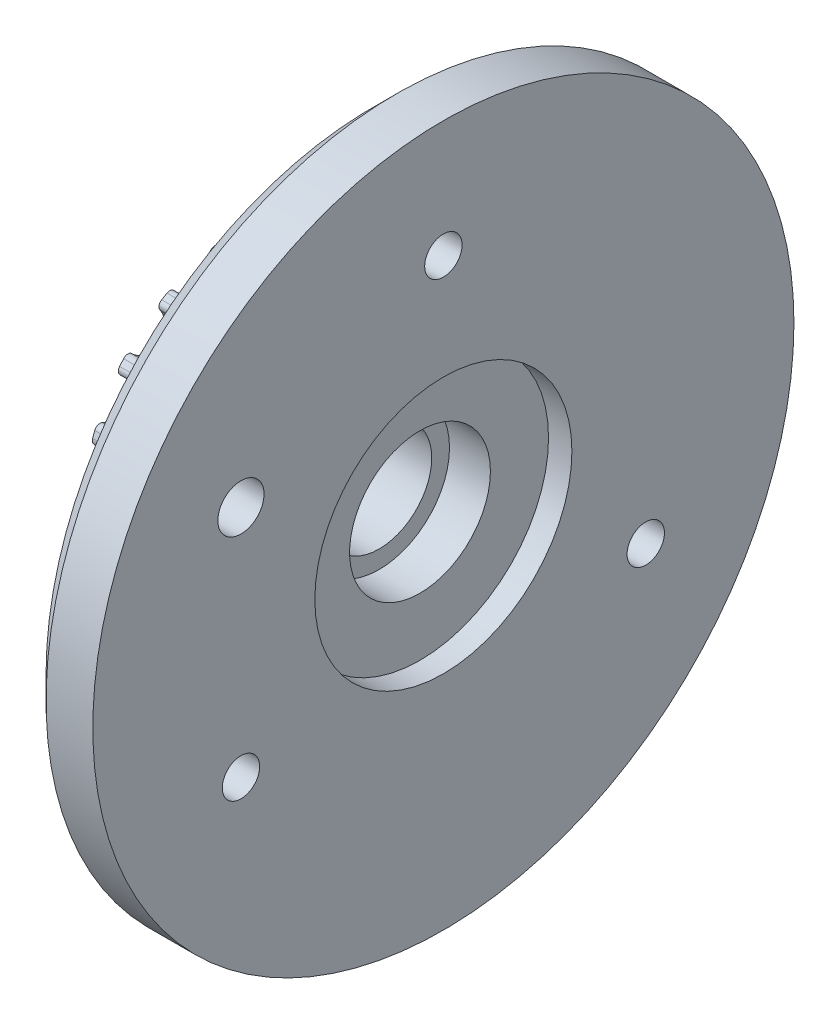
from build123d import *

# Parameters (mm, degrees)
SKETCH_1_W               = 11
SKETCH_1_H               = 10.9642
CUT_EXTRUDE_2_REACH      = 24.345
PATTERN_CIRCULAR_3_COUNT = 18
SKETCH_7_R               = 30
EXTRUDE_1_DEPTH          = 6
SKETCH_8_R               = 2.7888
EXTRUDE_2_DEPTH          = 11
SKETCH_10_R              = 11
CUT_EXTRUDE_3_DEPTH      = 2
SKETCH_11_R              = 1.6
CUT_EXTRUDE_4_DEPTH      = 44.829214002
PATTERN_CIRCULAR_4_COUNT = 3
SKETCH_13_R              = 1.975
CUT_EXTRUDE_5_DEPTH      = 44.829214002
CHAMFER_1_SIZE           = 0.8
CHAMFER_2_SIZE           = 2.5
CUT_EXTRUDE_START        = -15
SKETCH_14_R              = 4
CUT_EXTRUDE_6_DEPTH      = 10
SKETCH_15_R              = 4.5
CUT_EXTRUDE_7_DEPTH      = 46.705579528
CHAMFER_3_SIZE           = 2
SKETCH_17_R              = 6.025
CUT_EXTRUDE_8_DEPTH      = 3.5
CUT_EXTRUDE_START_2      = -3.4
SKETCH_18_R              = 6.025
CUT_EXTRUDE_9_DEPTH      = 3.4


with BuildPart() as part:
    # 草图1 → 旋转1 (revolve)
    with BuildSketch(Plane.XY, mode=Mode.PRIVATE) as revolve_1_sk:
        with Locations((5.5, 8.2709)):
            Rectangle(SKETCH_1_W, SKETCH_1_H)
    revolve(revolve_1_sk.sketch.rotate(Axis((0, 0, 0), (1, 0, 0)), 90), axis=Axis((0, 0, 0), (1, 0, 0)))

    # 草图6 → 切除-拉伸2 (cut, up to next)
    with BuildSketch(Plane(origin=(0, 0, 0), x_dir=(0, 0, -1), z_dir=(1, 0, 0)), mode=Mode.PRIVATE) as cut_extrude_2_sk1:
        with BuildLine():
            Line((1.574067282, 13.17215513), (1.548371997, 12.962883824))
            ThreePointArc((1.548371997, 12.962883824), (0, 11.593), (-1.548371997, 12.962883824))
            Line((-1.548371997, 12.962883824), (-1.574067282, 13.17215513))
            ThreePointArc((-1.574067282, 13.17215513), (-1.761240253, 13.496717776), (-2.124642597, 13.587895453))
            ThreePointArc((-2.124642597, 13.587895453), (-2.36143787, 13.548749765), (-2.597513963, 13.505477785))
            Line((-2.597513963, 13.505477785), (-2.794161951, 15.107047128))
            ThreePointArc((-2.794161951, 15.107047128), (0, 15.363274844), (2.794161951, 15.107047128))
            Line((2.794161951, 15.107047128), (2.597513963, 13.505477785))
            ThreePointArc((2.597513963, 13.505477785), (2.36143787, 13.548749765), (2.124642597, 13.587895453))
            ThreePointArc((2.124642597, 13.587895453), (1.761240253, 13.496717776), (1.574067282, 13.17215513))
        make_face()
    cut_extrude_2_tool1 = extrude(cut_extrude_2_sk1.sketch, amount=CUT_EXTRUDE_2_REACH, mode=Mode.PRIVATE) & part.part
    cut_extrude_2 = cut_extrude_2_tool1.solids().sort_by_distance((0, 13.819423, 0))[0]
    add(cut_extrude_2, mode=Mode.SUBTRACT)

    # 阵列(圆周)3: 切除-拉伸2 ×18 about axis
    pattern_circular_3_axis = Axis((0, 0, 0), (1, 0, 0))
    for i in range(1, PATTERN_CIRCULAR_3_COUNT):
        add(cut_extrude_2.rotate(pattern_circular_3_axis, i * 360 / PATTERN_CIRCULAR_3_COUNT), mode=Mode.SUBTRACT)

    # 草图7 → 凸台-拉伸1 (add)
    with BuildSketch(Plane(origin=(11, 0, 0), x_dir=(0, 0, -1), z_dir=(1, 0, 0))):
        Circle(SKETCH_7_R)
    extrude(amount=EXTRUDE_1_DEPTH)

    # 草图8 → 凸台-拉伸2 (add)
    with BuildSketch(Plane.ZY):
        Circle(SKETCH_8_R)
    extrude(amount=-EXTRUDE_2_DEPTH)

    # 草图10 → 切除-拉伸3 (cut)
    with BuildSketch(Plane(origin=(17, 0, 0), x_dir=(0, 0, -1), z_dir=(1, 0, 0))):
        Circle(SKETCH_10_R)
    extrude(amount=-CUT_EXTRUDE_3_DEPTH, mode=Mode.SUBTRACT)

    # 草图11 → 切除-拉伸4 (cut, through all)
    with BuildSketch(Plane.ZY.offset(-11)):
        with Locations((0, 20)):
            Circle(SKETCH_11_R)
    cut_extrude_4 = extrude(amount=-CUT_EXTRUDE_4_DEPTH, mode=Mode.SUBTRACT)

    # 阵列(圆周)4: 切除-拉伸4 ×3 about axis
    pattern_circular_4_axis = Axis((0, 0, 0), (1, 0, 0))
    for i in range(1, PATTERN_CIRCULAR_4_COUNT):
        add(cut_extrude_4.rotate(pattern_circular_4_axis, i * 360 / PATTERN_CIRCULAR_4_COUNT), mode=Mode.SUBTRACT)

    # 草图13 → 切除-拉伸5 (cut, through all)
    with BuildSketch(Plane.ZY.offset(-11)):
        with Locations((17.320508076, 10)):
            Circle(SKETCH_13_R)
    extrude(amount=-CUT_EXTRUDE_5_DEPTH, mode=Mode.SUBTRACT)

    # 倒角1
    chamfer_1_edges = [part.edges().sort_by_distance(p)[0] for p in [
        (11, 10, 15.345508076),
    ]]
    chamfer(chamfer_1_edges, length=CHAMFER_1_SIZE)

    # 倒角2
    chamfer_2_edges = [part.edges().sort_by_distance(p)[0] for p in [
        (11, 20, -1.6),
        (11, -8.614359354, 18.120508076),
        (11, -11.385640646, -16.520508076),
    ]]
    chamfer(chamfer_2_edges, length=CHAMFER_2_SIZE)

    # 草图14 → 切除-拉伸6 (cut)
    with BuildSketch(Plane.ZY.offset(CUT_EXTRUDE_START)):
        with Locations(Location((0, 0, 0), (0, 0, 180))):
            Circle(SKETCH_14_R)
    extrude(amount=CUT_EXTRUDE_6_DEPTH, mode=Mode.SUBTRACT)

    # 草图15 → 切除-拉伸7 (cut, through all)
    with BuildSketch(Plane.ZY):
        Circle(SKETCH_15_R)
    extrude(amount=-CUT_EXTRUDE_7_DEPTH, mode=Mode.SUBTRACT)

    # 倒角3
    chamfer_3_edges = [part.edges().sort_by_distance(p)[0] for p in [
        (11, 0, 30),
    ]]
    chamfer(chamfer_3_edges, length=CHAMFER_3_SIZE)

    # 草图17 → 切除-拉伸8 (cut)
    with BuildSketch(Plane(origin=(15, 0, 0), x_dir=(0, 0, -1), z_dir=(1, 0, 0))):
        Circle(SKETCH_17_R)
    extrude(amount=-CUT_EXTRUDE_8_DEPTH, mode=Mode.SUBTRACT)

    # 草图18 → 切除-拉伸9 (cut)
    with BuildSketch(Plane.ZY.offset(CUT_EXTRUDE_START_2)):
        with Locations(Location((0, 0, 0), (0, 0, 180))):
            Circle(SKETCH_18_R)
    extrude(amount=CUT_EXTRUDE_9_DEPTH, mode=Mode.SUBTRACT)


solid = part.part
